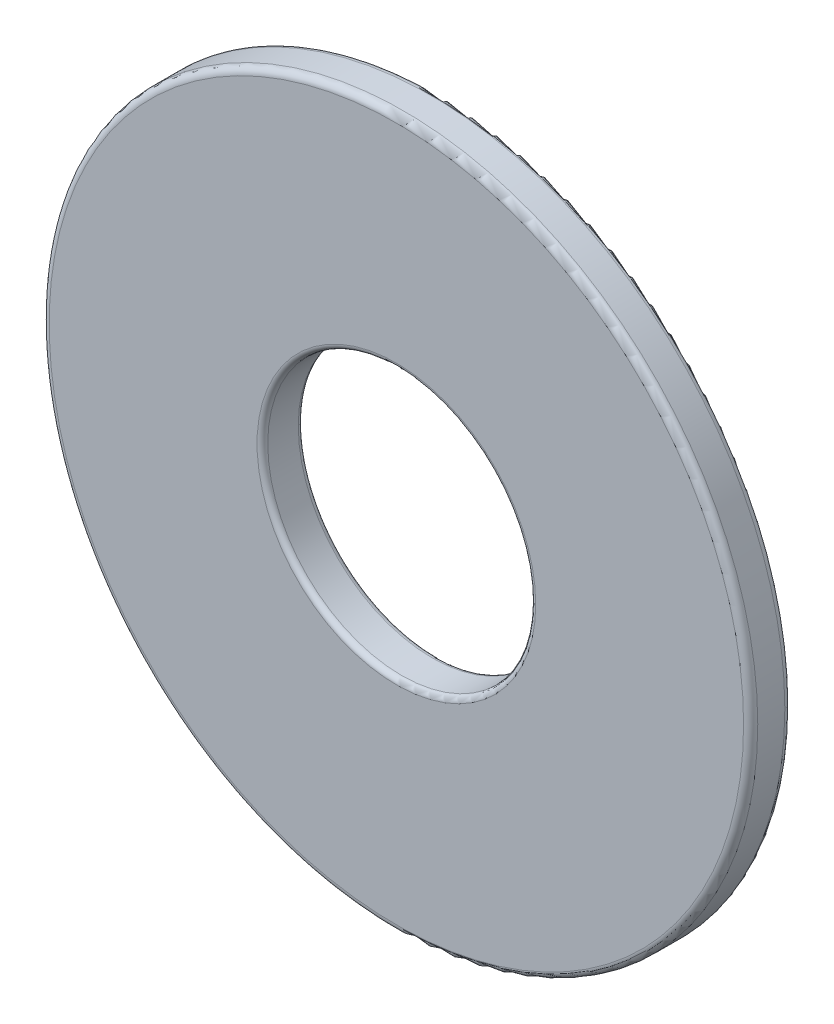
from build123d import *

# Parameters (mm, degrees)
BOSS_EXTRUDE1_DEPTH      = 0.508
BOSS_EXTRUDE1_DEPTH_BACK = 0.508
SKETCH3_R                = 8.73125
SKETCH3_R_2              = 3.302
FILLET1_R                = 0.13208
FILLET2_R                = 0.174625


with BuildPart() as part:
    # Sketch3 → Boss-Extrude1 (new, two sides: drawn at the far end of the back side and taken through both)
    with BuildSketch(Plane.XY.offset(-BOSS_EXTRUDE1_DEPTH_BACK)):
        Circle(SKETCH3_R)
        Circle(SKETCH3_R_2, mode=Mode.SUBTRACT)
    extrude(amount=BOSS_EXTRUDE1_DEPTH + BOSS_EXTRUDE1_DEPTH_BACK)

    # Fillet1
    fillet1_edges = [part.edges().sort_by_distance(p)[0] for p in [
        (-3.302, 0, 0.508),
        (-3.302, 0, -0.508),
    ]]
    fillet(fillet1_edges, radius=FILLET1_R)

    # Fillet2
    fillet2_edges = [part.edges().sort_by_distance(p)[0] for p in [
        (-8.73125, 0, 0.508),
        (-8.73125, 0, -0.508),
    ]]
    fillet(fillet2_edges, radius=FILLET2_R)


solid = part.part
